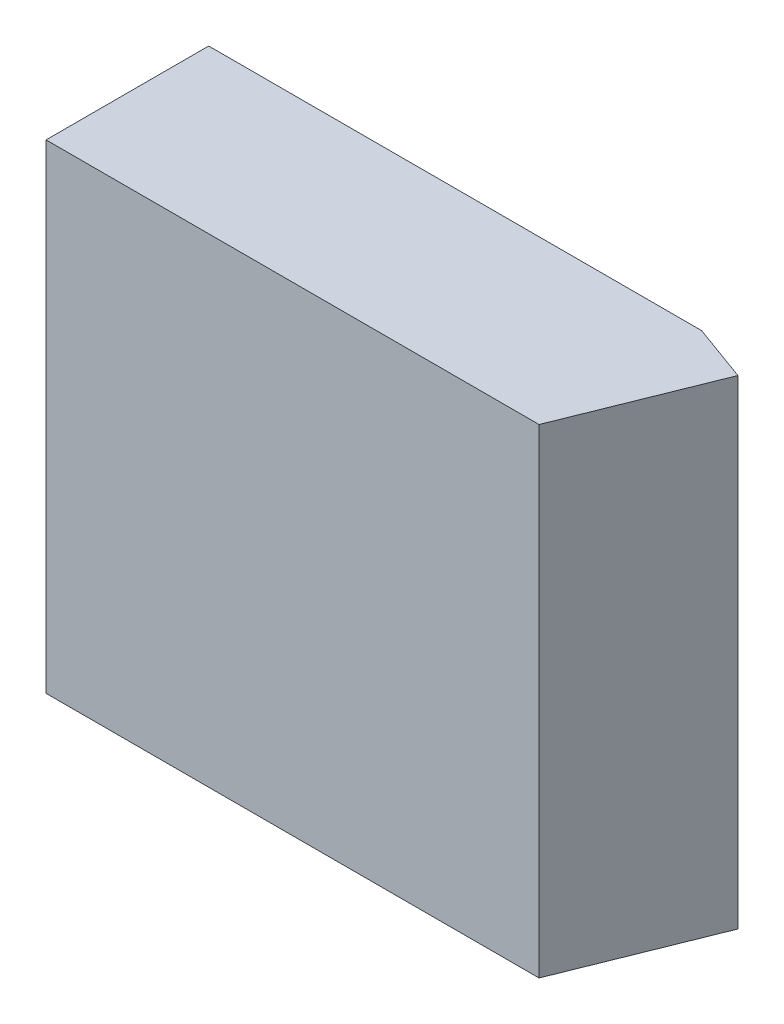
from build123d import *

# Parameters (mm, degrees)
BOSS_EXTRUDE1_DEPTH = 474.18


with BuildPart() as part:
    # Sketch2 → Boss-Extrude1 (new body)
    with BuildSketch(Plane(origin=(0, 0, 0), x_dir=(1, 0, 0), z_dir=(0, 1, 0))):
        Polygon((-243.84, 0), (243.84, 0), (300.221557247, -20.5212086), (243.84, -160.86), (-243.84, -160.86), align=None)
    extrude(amount=BOSS_EXTRUDE1_DEPTH)


solid = part.part
